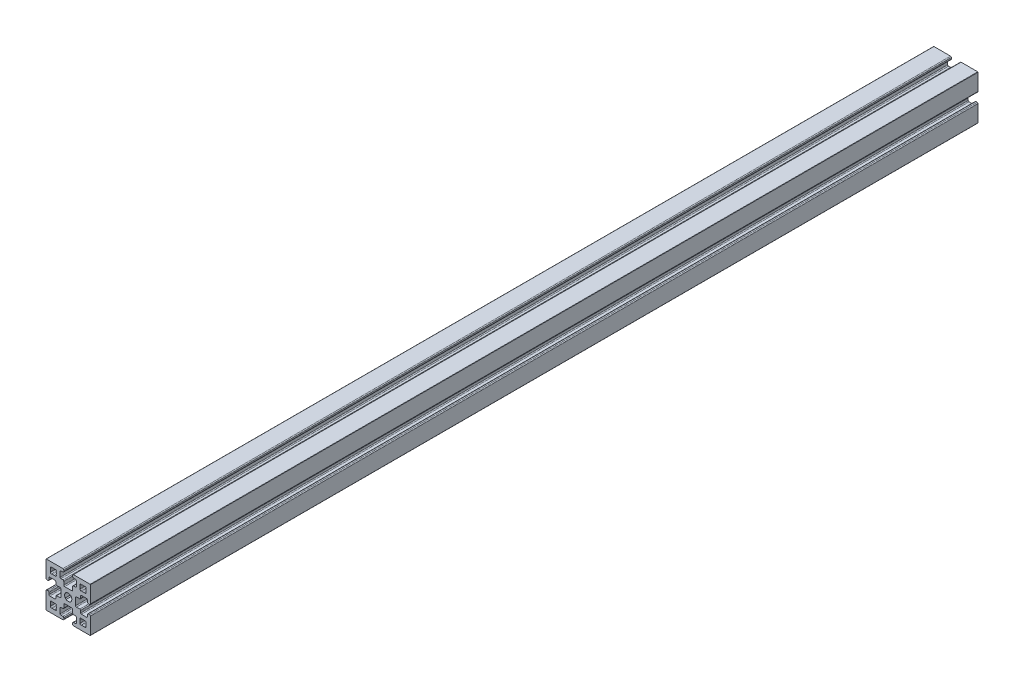
from build123d import *

# Parameters (mm, degrees)
SKETCH1_W             = 500
SKETCH1_H             = 15
BOSS_EXTRUDE1_DEPTH   = 15
CUT_EXTRUDE1_DEPTH    = 501.112487347
SKETCH3_W             = 2.3
SKETCH3_H             = 1.25
CUT_EXTRUDE2_DEPTH    = 501.112487347
CUT_EXTRUDE3_DEPTH    = 501.112487347
SKETCH5_W             = 1.25
SKETCH5_H             = 2.3
CUT_EXTRUDE4_DEPTH    = 501.112487347
CUT_EXTRUDE5_DEPTH    = 501.112487347
SKETCH7_W             = 2.3
SKETCH7_H             = 1.25
CUT_EXTRUDE6_DEPTH    = 501.112487347
CUT_EXTRUDE7_DEPTH    = 501.112487347
SKETCH9_W             = 3
SKETCH9_H             = 1.7
CUT_EXTRUDE8_DEPTH    = 501.112487347
SKETCH10_R            = 1.2295
CUT_EXTRUDE9_DEPTH    = 8
SKETCH11_R            = 1.229499998
CUT_EXTRUDE10_DEPTH   = 0.137897512
CUT_EXTRUDE10_DRAFT   = -58.999999936
SKETCH12_R            = 1
CUT_EXTRUDE11_DEPTH   = 483.724204976
SKETCH13_R            = 1
CUT_EXTRUDE12_DEPTH   = 0.137897512
CUT_EXTRUDE12_DRAFT   = 59
CUT_EXTRUDE13_START   = -8
SKETCH14_R            = 1.2295
CUT_EXTRUDE13_DEPTH   = 8
SKETCH15_W            = 0.292893219
SKETCH15_H            = 500
SKETCH16_W            = 0.292893219
SKETCH16_H            = 500
SKETCH17_W            = 0.292893219
SKETCH17_H            = 500
SKETCH18_W            = 0.292893219
SKETCH18_H            = 500
F_1_CLEARANCE_HOLE1_D = 2
HOLE1_D               = 0.585786438
FILLET1_R             = 0.1
FILLET2_R             = 0.3
FILLET3_R             = 0.5


with BuildPart() as part:
    # Sketch1 → Boss-Extrude1 (new body)
    with BuildSketch(Plane(origin=(7.5, 0, 0), x_dir=(0, 0, -1), z_dir=(1, 0, 0))):
        with Locations((245, 0)):
            Rectangle(SKETCH1_W, SKETCH1_H)
    extrude(amount=-BOSS_EXTRUDE1_DEPTH)

    # Sketch2 → Cut-Extrude1 (cut, through all)
    with BuildSketch(Plane.XY.offset(5)):
        Polygon((-7.5, 1.5), (-7.5, -1.5), (-6.5, -1.5), (-6.5, -2.75), (-4.2, -2.75), (-4.2, -1.5), (-2.5, -1.5), (-2.5, 1.5), align=None)
    extrude(amount=-CUT_EXTRUDE1_DEPTH, mode=Mode.SUBTRACT)

    # Sketch3 → Cut-Extrude2 (cut, through all)
    with BuildSketch(Plane.XY.offset(5)):
        with Locations((-5.35, 2.125)):
            Rectangle(SKETCH3_W, SKETCH3_H)
    extrude(amount=-CUT_EXTRUDE2_DEPTH, mode=Mode.SUBTRACT)

    # Sketch4 → Cut-Extrude3 (cut, through all)
    with BuildSketch(Plane.XY.offset(5)):
        Polygon((1.5, 7.5), (-1.5, 7.5), (-1.5, 6.5), (-2.75, 6.5), (-2.75, 4.2), (-1.5, 4.2), (-1.5, 2.5), (1.5, 2.5), align=None)
    extrude(amount=-CUT_EXTRUDE3_DEPTH, mode=Mode.SUBTRACT)

    # Sketch5 → Cut-Extrude4 (cut, through all)
    with BuildSketch(Plane.XY.offset(5)):
        with Locations((2.125, 5.35)):
            Rectangle(SKETCH5_W, SKETCH5_H)
    extrude(amount=-CUT_EXTRUDE4_DEPTH, mode=Mode.SUBTRACT)

    # Sketch6 → Cut-Extrude5 (cut, through all)
    with BuildSketch(Plane.XY.offset(5)):
        Polygon((7.5, -1.5), (7.5, 1.5), (6.5, 1.5), (6.5, 2.75), (4.2, 2.75), (4.2, 1.5), (2.5, 1.5), (2.5, -1.5), align=None)
    extrude(amount=-CUT_EXTRUDE5_DEPTH, mode=Mode.SUBTRACT)

    # Sketch7 → Cut-Extrude6 (cut, through all)
    with BuildSketch(Plane.XY.offset(5)):
        with Locations((5.35, -2.125)):
            Rectangle(SKETCH7_W, SKETCH7_H)
    extrude(amount=-CUT_EXTRUDE6_DEPTH, mode=Mode.SUBTRACT)

    # Sketch8 → Cut-Extrude7 (cut, through all)
    with BuildSketch(Plane.XY.offset(5)):
        Polygon((-1.5, -7.5), (1.5, -7.5), (1.5, -6.5), (2.75, -6.5), (2.75, -4.2), (-2.75, -4.2), (-2.75, -6.5), (-1.5, -6.5), align=None)
    extrude(amount=-CUT_EXTRUDE7_DEPTH, mode=Mode.SUBTRACT)

    # Sketch9 → Cut-Extrude8 (cut, through all)
    with BuildSketch(Plane.XY.offset(5)):
        with Locations((0, -3.35)):
            Rectangle(SKETCH9_W, SKETCH9_H)
    extrude(amount=-CUT_EXTRUDE8_DEPTH, mode=Mode.SUBTRACT)

    # Sketch10 → Cut-Extrude9 (cut)
    with BuildSketch(Plane(origin=(0, 0, -495), x_dir=(-1, 0, 0), z_dir=(0, 0, -1))):
        with Locations(Location((0, 0, 0), (0, 0, 180))):
            Circle(SKETCH10_R)
    extrude(amount=-CUT_EXTRUDE9_DEPTH, mode=Mode.SUBTRACT)


with BuildPart() as cut_extrude10_tool:
    # Sketch11 → Cut-Extrude10 (with draft: the straight prism first)
    with BuildSketch(Plane(origin=(0, 0, -487), x_dir=(-1, 0, 0), z_dir=(0, 0, -1))):
        with Locations(Location((0, 0, 0), (0, 0, 180))):
            Circle(SKETCH11_R)
    extrude(amount=-CUT_EXTRUDE10_DEPTH)
    # Cut-Extrude10: the draft: its side faces are tilted about the plane it starts from
    cut_extrude10_sides = [cut_extrude10_tool.faces().sort_by_distance(p)[0] for p in [
        (-1.229499998, 0, -486.931051244),
    ]]
    draft(cut_extrude10_sides, Plane(origin=(0, 0, -487), x_dir=(-1, 0, 0), z_dir=(0, 0, -1)), CUT_EXTRUDE10_DRAFT)


with BuildPart() as part_1:
    add(part.part)

    # Cut-Extrude10: cut by cut_extrude10_tool
    add(cut_extrude10_tool.part, mode=Mode.SUBTRACT)

    # Sketch12 → Cut-Extrude11 (cut)
    with BuildSketch(Plane(origin=(0, 0, -486.862102488), x_dir=(-1, 0, 0), z_dir=(0, 0, -1))):
        with Locations(Location((0, 0, 0), (0, 0, 180))):
            Circle(SKETCH12_R)
    extrude(amount=-CUT_EXTRUDE11_DEPTH, mode=Mode.SUBTRACT)


with BuildPart() as cut_extrude12_tool:
    # Sketch13 → Cut-Extrude12 (with draft: the straight prism first)
    with BuildSketch(Plane(origin=(0, 0, -3.137897512), x_dir=(-1, 0, 0), z_dir=(0, 0, -1))):
        with Locations(Location((0, 0, 0), (0, 0, 180))):
            Circle(SKETCH13_R)
    extrude(amount=-CUT_EXTRUDE12_DEPTH)
    # Cut-Extrude12: the draft: its side faces are tilted about the plane it starts from
    cut_extrude12_sides = [cut_extrude12_tool.faces().sort_by_distance(p)[0] for p in [
        (-1, 0, -3.068948756),
    ]]
    draft(cut_extrude12_sides, Plane(origin=(0, 0, -3.137897512), x_dir=(-1, 0, 0), z_dir=(0, 0, -1)), CUT_EXTRUDE12_DRAFT)


with BuildPart() as part_2:
    add(part_1.part)

    # Cut-Extrude12: cut by cut_extrude12_tool
    add(cut_extrude12_tool.part, mode=Mode.SUBTRACT)

    # Sketch14 → Cut-Extrude13 (cut)
    with BuildSketch(Plane.XY.offset(5).offset(CUT_EXTRUDE13_START)):
        Circle(SKETCH14_R)
    extrude(amount=CUT_EXTRUDE13_DEPTH, mode=Mode.SUBTRACT)

    # Sketch15 → Cut-Revolve1 (revolve, cut)
    with BuildSketch(Plane.XZ.offset(-0.707106781)):
        with Locations((-0.560660172, -245)):
            Rectangle(SKETCH15_W, SKETCH15_H)
    revolve(axis=Axis((-0.707106781, 0.707106781, 5), (0, 0, -1)), mode=Mode.SUBTRACT)

    # Sketch16 → Cut-Revolve2 (revolve, cut)
    with BuildSketch(Plane.XZ.offset(-0.707106781)):
        with Locations((0.853553391, -245)):
            Rectangle(SKETCH16_W, SKETCH16_H)
    revolve(axis=Axis((0.707106781, 0.707106781, 5), (0, 0, -1)), mode=Mode.SUBTRACT)

    # Sketch17 → Cut-Revolve3 (revolve, cut)
    with BuildSketch(Plane(origin=(0, -0.707106781, 0), x_dir=(1, 0, 0), z_dir=(0, 1, 0))):
        with Locations((0.853553391, 245)):
            Rectangle(SKETCH17_W, SKETCH17_H)
    revolve(axis=Axis((0.707106781, -0.707106781, -495), (0, 0, 1)), mode=Mode.SUBTRACT)

    # Sketch18 → Cut-Revolve4 (revolve, cut)
    with BuildSketch(Plane.XZ.offset(0.707106781)):
        with Locations((-0.560660172, -245)):
            Rectangle(SKETCH18_W, SKETCH18_H)
    revolve(axis=Axis((-0.707106781, -0.707106781, 5), (0, 0, -1)), mode=Mode.SUBTRACT)

    # #1 Clearance Hole1 (through all)
    with Locations(Plane.XY.offset(5)):
        with Locations((5, -5), (-5, 5), (5, 5), (-5, -5)):
            Hole(F_1_CLEARANCE_HOLE1_D / 2)

    # Hole1 (through all)
    with Locations(Plane.XY.offset(5)):
        with Locations((4.292893219, 4.292893219), (5.707106781, 4.292893219), (4.292893219, 5.707106781), (5.707106781, 5.707106781), (-4.292893219, -4.292893219), (-5.707106781, -4.292893219), (-4.292893219, -5.707106781), (-5.707106781, -5.707106781), (-4.292893219, 5.707106781), (-4.292893219, 4.292893219), (-5.707106781, 5.707106781), (-5.707106781, 4.292893219), (4.292893219, -5.707106781), (4.292893219, -4.292893219), (5.707106781, -5.707106781), (5.707106781, -4.292893219)):
            Hole(HOLE1_D / 2)

    # Fillet1
    fillet1_edges = [part_2.edges().sort_by_distance(p)[0] for p in [
        (-7.5, -7.5, -245),
        (-7.5, 7.5, -245),
        (7.5, -7.5, -245),
        (7.5, 7.5, -245),
    ]]
    fillet(fillet1_edges, radius=FILLET1_R)

    # Fillet2
    fillet2_edges = [part_2.edges().sort_by_distance(p)[0] for p in [
        (7.5, -1.5, -245),
        (2.5, -1.5, -245),
        (2.5, 1.5, -245),
        (4.2, 1.5, -245),
        (4.2, 2.75, -245),
        (6.5, 2.75, -245),
        (6.5, 1.5, -245),
        (7.5, 1.5, -245),
        (6.5, -1.5, -245),
        (6.5, -2.75, -245),
        (4.2, -2.75, -245),
        (4.2, -1.5, -245),
        (-1.5, -7.5, -245),
        (-1.5, -6.5, -245),
        (-2.75, -6.5, -245),
        (-2.75, -4.2, -245),
        (2.75, -4.2, -245),
        (2.75, -6.5, -245),
        (1.5, -6.5, -245),
        (1.5, -7.5, -245),
        (-1.5, -4.2, -245),
        (-1.5, -2.5, -245),
        (1.5, -2.5, -245),
        (1.5, -4.2, -245),
        (-7.5, 1.5, -245),
        (-2.5, 1.5, -245),
        (-2.5, -1.5, -245),
        (-4.2, -1.5, -245),
        (-4.2, -2.75, -245),
        (-6.5, -2.75, -245),
        (-6.5, -1.5, -245),
        (-7.5, -1.5, -245),
        (-6.5, 1.5, -245),
        (-6.5, 2.75, -245),
        (-4.2, 2.75, -245),
        (-4.2, 1.5, -245),
        (1.5, 7.5, -245),
        (1.5, 2.5, -245),
        (-1.5, 2.5, -245),
        (-1.5, 4.2, -245),
        (-2.75, 4.2, -245),
        (-2.75, 6.5, -245),
        (-1.5, 6.5, -245),
        (-1.5, 7.5, -245),
        (1.5, 6.5, -245),
        (2.75, 6.5, -245),
        (2.75, 4.2, -245),
        (1.5, 4.2, -245),
    ]]
    fillet(fillet2_edges, radius=FILLET2_R)

    # Fillet3
    fillet3_edges = [part_2.edges().sort_by_distance(p)[0] for p in [
        (5.47190282, -4.118349429, -245),
        (5.881650571, -4.52809718, -245),
        (5.881650571, -5.47190282, -245),
        (5.47190282, -5.881650571, -245),
        (4.118349429, -4.52809718, -245),
        (4.52809718, -4.118349429, -245),
        (4.52809718, -5.881650571, -245),
        (4.118349429, -5.47190282, -245),
        (-5.47190282, 4.118349429, -245),
        (-5.881650571, 4.52809718, -245),
        (-5.881650571, 5.47190282, -245),
        (-5.47190282, 5.881650571, -245),
        (-4.118349429, 4.52809718, -245),
        (-4.52809718, 4.118349429, -245),
        (-4.52809718, 5.881650571, -245),
        (-4.118349429, 5.47190282, -245),
        (-5.47190282, -5.881650571, -245),
        (-5.881650571, -5.47190282, -245),
        (-4.118349429, -5.47190282, -245),
        (-4.52809718, -5.881650571, -245),
        (-5.881650571, -4.52809718, -245),
        (-5.47190282, -4.118349429, -245),
        (-4.52809718, -4.118349429, -245),
        (-4.118349429, -4.52809718, -245),
        (5.47190282, 5.881650571, -245),
        (5.881650571, 5.47190282, -245),
        (4.118349429, 5.47190282, -245),
        (4.52809718, 5.881650571, -245),
        (5.881650571, 4.52809718, -245),
        (5.47190282, 4.118349429, -245),
        (4.52809718, 4.118349429, -245),
        (4.118349429, 4.52809718, -245),
    ]]
    fillet(fillet3_edges, radius=FILLET3_R)

    # Split1
    split(bisect_by=Plane.XY.offset(-295), keep=Keep.TOP)


solid = part_2.part
